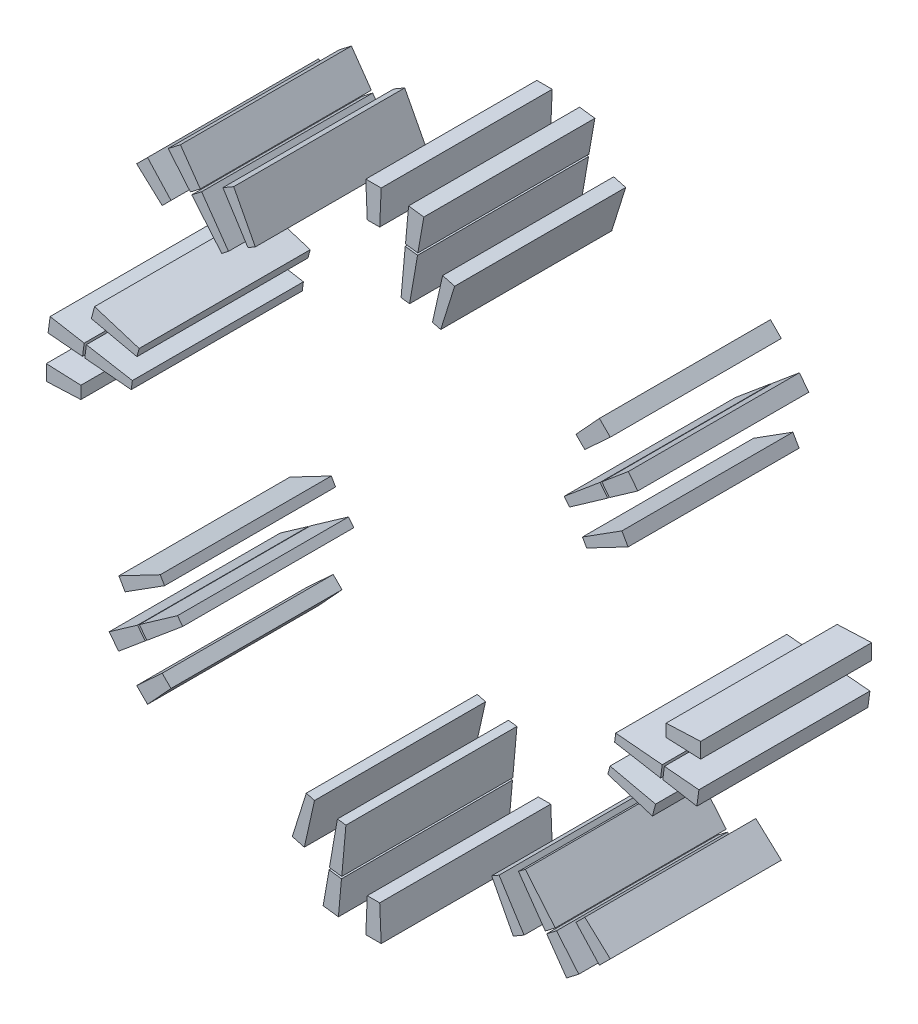
from build123d import *

# Parameters (mm, degrees)
SLOT_COPPER_ENVELOPES_START    = -15
SLOT_COPPER_ENVELOPES_DEPTH    = 30
SLOT_COPPER_ENVELOPES_2_DEPTH  = 30
SLOT_COPPER_ENVELOPES_3_DEPTH  = 30
SLOT_COPPER_ENVELOPES_4_DEPTH  = 30
SLOT_COPPER_ENVELOPES_5_DEPTH  = 30
SLOT_COPPER_ENVELOPES_6_DEPTH  = 30
SLOT_COPPER_ENVELOPES_7_DEPTH  = 30
SLOT_COPPER_ENVELOPES_8_DEPTH  = 30
SLOT_COPPER_ENVELOPES_9_DEPTH  = 30
SLOT_COPPER_ENVELOPES_10_DEPTH = 30
SLOT_COPPER_ENVELOPES_11_DEPTH = 30
SLOT_COPPER_ENVELOPES_12_DEPTH = 30
SLOT_COPPER_ENVELOPES_13_DEPTH = 30
SLOT_COPPER_ENVELOPES_14_DEPTH = 30
SLOT_COPPER_ENVELOPES_15_DEPTH = 30
SLOT_COPPER_ENVELOPES_16_DEPTH = 30
SLOT_COPPER_ENVELOPES_17_DEPTH = 30
SLOT_COPPER_ENVELOPES_18_DEPTH = 30
SLOT_COPPER_ENVELOPES_19_DEPTH = 30
SLOT_COPPER_ENVELOPES_20_DEPTH = 30
SLOT_COPPER_ENVELOPES_21_DEPTH = 30
SLOT_COPPER_ENVELOPES_22_DEPTH = 30
SLOT_COPPER_ENVELOPES_23_DEPTH = 30
SLOT_COPPER_ENVELOPES_24_DEPTH = 30
SLOT_COPPER_ENVELOPES_25_DEPTH = 30
SLOT_COPPER_ENVELOPES_26_DEPTH = 30
SLOT_COPPER_ENVELOPES_27_DEPTH = 30
SLOT_COPPER_ENVELOPES_28_DEPTH = 30
SLOT_COPPER_ENVELOPES_29_DEPTH = 30
SLOT_COPPER_ENVELOPES_30_DEPTH = 30
SLOT_COPPER_ENVELOPES_31_DEPTH = 30
SLOT_COPPER_ENVELOPES_32_DEPTH = 30


with BuildPart() as part:
    # Эскиз1 → Slot_copper_envelopes (new body)
    with BuildSketch(Plane.XY.offset(SLOT_COPPER_ENVELOPES_START)):
        Polygon((51.326850344, -1.091818182), (57.392307692, -1.35), (57.392307692, 1.35), (51.326850344, 1.091818182), align=None)
    extrude(amount=SLOT_COPPER_ENVELOPES_DEPTH)


with BuildPart() as body_2:
    # Эскиз1 → Slot_copper_envelopes 2 (new body)
    with BuildSketch(Plane.XY.offset(SLOT_COPPER_ENVELOPES_START)):
        Polygon((37.401882176, 20.727961339), (44.659910813, 24.523688487), (43.568092631, 26.414773051), (36.651882176, 22.026999445), align=None)
    extrude(amount=SLOT_COPPER_ENVELOPES_2_DEPTH)


with BuildPart() as body_3:
    # Эскиз1 → Slot_copper_envelopes 3 (new body)
    with BuildSketch(Plane.XY.offset(SLOT_COPPER_ENVELOPES_START)):
        Polygon((41.384984963, 30.37960916), (46.354206944, 33.867196235), (44.710551086, 36.009250254), (40.05567137, 32.112004363), align=None)
    extrude(amount=SLOT_COPPER_ENVELOPES_3_DEPTH)


with BuildPart() as body_4:
    # Эскиз1 → Slot_copper_envelopes 4 (new body)
    with BuildSketch(Plane.XY.offset(SLOT_COPPER_ENVELOPES_START)):
        Polygon((34.376362023, 25.432556019), (41.076855407, 30.143173036), (39.747541814, 31.875568239), (33.46321988, 26.622586029), align=None)
    extrude(amount=SLOT_COPPER_ENVELOPES_4_DEPTH)


with BuildPart() as body_5:
    # Эскиз1 → Slot_copper_envelopes 5 (new body)
    with BuildSketch(Plane.XY.offset(SLOT_COPPER_ENVELOPES_START)):
        Polygon((37.065595975, 35.521531895), (41.537084112, 39.627895803), (39.627895803, 41.537084112), (35.521531895, 37.065595975), align=None)
    extrude(amount=SLOT_COPPER_ENVELOPES_5_DEPTH)


with BuildPart() as body_6:
    # Эскиз1 → Slot_copper_envelopes 6 (new body)
    with BuildSketch(Plane.XY.offset(SLOT_COPPER_ENVELOPES_START)):
        Polygon((11.790242493, 41.104006539), (14.238459354, 48.920192212), (12.129228595, 49.485358891), (10.341353754, 41.492235107), align=None)
    extrude(amount=SLOT_COPPER_ENVELOPES_6_DEPTH)


with BuildPart() as body_7:
    # Эскиз1 → Slot_copper_envelopes 7 (new body)
    with BuildSketch(Plane.XY.offset(SLOT_COPPER_ENVELOPES_START)):
        Polygon((7.78197586, 50.745231154), (8.829649949, 56.725098184), (6.152748823, 57.077518903), (5.617020808, 51.030252894), align=None)
    extrude(amount=SLOT_COPPER_ENVELOPES_7_DEPTH)


with BuildPart() as body_8:
    # Эскиз1 → Slot_copper_envelopes 8 (new body)
    with BuildSketch(Plane.XY.offset(SLOT_COPPER_ENVELOPES_START)):
        Polygon((6.324225876, 42.291291523), (7.731280948, 50.360165069), (5.566325896, 50.645186808), (4.837058584, 42.487080811), align=None)
    extrude(amount=SLOT_COPPER_ENVELOPES_8_DEPTH)


with BuildPart() as body_9:
    # Эскиз1 → Slot_copper_envelopes 9 (new body)
    with BuildSketch(Plane.XY.offset(SLOT_COPPER_ENVELOPES_START)):
        Polygon((1.091818182, 51.326850344), (1.35, 57.392307692), (-1.35, 57.392307692), (-1.091818182, 51.326850344), align=None)
    extrude(amount=SLOT_COPPER_ENVELOPES_9_DEPTH)


with BuildPart() as body_10:
    # Эскиз1 → Slot_copper_envelopes 10 (new body)
    with BuildSketch(Plane.XY.offset(SLOT_COPPER_ENVELOPES_START)):
        Polygon((-20.727961339, 37.401882176), (-24.523688487, 44.659910813), (-26.414773051, 43.568092631), (-22.026999445, 36.651882176), align=None)
    extrude(amount=SLOT_COPPER_ENVELOPES_10_DEPTH)


with BuildPart() as body_11:
    # Эскиз1 → Slot_copper_envelopes 11 (new body)
    with BuildSketch(Plane.XY.offset(SLOT_COPPER_ENVELOPES_START)):
        Polygon((-30.37960916, 41.384984963), (-33.867196235, 46.354206944), (-36.009250254, 44.710551086), (-32.112004363, 40.05567137), align=None)
    extrude(amount=SLOT_COPPER_ENVELOPES_11_DEPTH)


with BuildPart() as body_12:
    # Эскиз1 → Slot_copper_envelopes 12 (new body)
    with BuildSketch(Plane.XY.offset(SLOT_COPPER_ENVELOPES_START)):
        Polygon((-25.432556019, 34.376362023), (-30.143173036, 41.076855407), (-31.875568239, 39.747541814), (-26.622586029, 33.46321988), align=None)
    extrude(amount=SLOT_COPPER_ENVELOPES_12_DEPTH)


with BuildPart() as body_13:
    # Эскиз1 → Slot_copper_envelopes 13 (new body)
    with BuildSketch(Plane.XY.offset(SLOT_COPPER_ENVELOPES_START)):
        Polygon((-35.521531895, 37.065595975), (-39.627895803, 41.537084112), (-41.537084112, 39.627895803), (-37.065595975, 35.521531895), align=None)
    extrude(amount=SLOT_COPPER_ENVELOPES_13_DEPTH)


with BuildPart() as body_14:
    # Эскиз1 → Slot_copper_envelopes 14 (new body)
    with BuildSketch(Plane.XY.offset(SLOT_COPPER_ENVELOPES_START)):
        Polygon((-41.104006539, 11.790242493), (-48.920192212, 14.238459354), (-49.485358891, 12.129228595), (-41.492235107, 10.341353754), align=None)
    extrude(amount=SLOT_COPPER_ENVELOPES_14_DEPTH)


with BuildPart() as body_15:
    # Эскиз1 → Slot_copper_envelopes 15 (new body)
    with BuildSketch(Plane.XY.offset(SLOT_COPPER_ENVELOPES_START)):
        Polygon((-50.745231154, 7.78197586), (-56.725098184, 8.829649949), (-57.077518903, 6.152748823), (-51.030252894, 5.617020808), align=None)
    extrude(amount=SLOT_COPPER_ENVELOPES_15_DEPTH)


with BuildPart() as body_16:
    # Эскиз1 → Slot_copper_envelopes 16 (new body)
    with BuildSketch(Plane.XY.offset(SLOT_COPPER_ENVELOPES_START)):
        Polygon((-42.291291523, 6.324225876), (-50.360165069, 7.731280948), (-50.645186808, 5.566325896), (-42.487080811, 4.837058584), align=None)
    extrude(amount=SLOT_COPPER_ENVELOPES_16_DEPTH)


with BuildPart() as body_17:
    # Эскиз1 → Slot_copper_envelopes 17 (new body)
    with BuildSketch(Plane.XY.offset(SLOT_COPPER_ENVELOPES_START)):
        Polygon((-51.326850344, 1.091818182), (-57.392307692, 1.35), (-57.392307692, -1.35), (-51.326850344, -1.091818182), align=None)
    extrude(amount=SLOT_COPPER_ENVELOPES_17_DEPTH)


with BuildPart() as body_18:
    # Эскиз1 → Slot_copper_envelopes 18 (new body)
    with BuildSketch(Plane.XY.offset(SLOT_COPPER_ENVELOPES_START)):
        Polygon((-37.401882176, -20.727961339), (-44.659910813, -24.523688487), (-43.568092631, -26.414773051), (-36.651882176, -22.026999445), align=None)
    extrude(amount=SLOT_COPPER_ENVELOPES_18_DEPTH)


with BuildPart() as body_19:
    # Эскиз1 → Slot_copper_envelopes 19 (new body)
    with BuildSketch(Plane.XY.offset(SLOT_COPPER_ENVELOPES_START)):
        Polygon((-41.384984963, -30.37960916), (-46.354206944, -33.867196235), (-44.710551086, -36.009250254), (-40.05567137, -32.112004363), align=None)
    extrude(amount=SLOT_COPPER_ENVELOPES_19_DEPTH)


with BuildPart() as body_20:
    # Эскиз1 → Slot_copper_envelopes 20 (new body)
    with BuildSketch(Plane.XY.offset(SLOT_COPPER_ENVELOPES_START)):
        Polygon((-34.376362023, -25.432556019), (-41.076855407, -30.143173036), (-39.747541814, -31.875568239), (-33.46321988, -26.622586029), align=None)
    extrude(amount=SLOT_COPPER_ENVELOPES_20_DEPTH)


with BuildPart() as body_21:
    # Эскиз1 → Slot_copper_envelopes 21 (new body)
    with BuildSketch(Plane.XY.offset(SLOT_COPPER_ENVELOPES_START)):
        Polygon((-37.065595975, -35.521531895), (-41.537084112, -39.627895803), (-39.627895803, -41.537084112), (-35.521531895, -37.065595975), align=None)
    extrude(amount=SLOT_COPPER_ENVELOPES_21_DEPTH)


with BuildPart() as body_22:
    # Эскиз1 → Slot_copper_envelopes 22 (new body)
    with BuildSketch(Plane.XY.offset(SLOT_COPPER_ENVELOPES_START)):
        Polygon((-11.790242493, -41.104006539), (-14.238459354, -48.920192212), (-12.129228595, -49.485358891), (-10.341353754, -41.492235107), align=None)
    extrude(amount=SLOT_COPPER_ENVELOPES_22_DEPTH)


with BuildPart() as body_23:
    # Эскиз1 → Slot_copper_envelopes 23 (new body)
    with BuildSketch(Plane.XY.offset(SLOT_COPPER_ENVELOPES_START)):
        Polygon((-7.78197586, -50.745231154), (-8.829649949, -56.725098184), (-6.152748823, -57.077518903), (-5.617020808, -51.030252894), align=None)
    extrude(amount=SLOT_COPPER_ENVELOPES_23_DEPTH)


with BuildPart() as body_24:
    # Эскиз1 → Slot_copper_envelopes 24 (new body)
    with BuildSketch(Plane.XY.offset(SLOT_COPPER_ENVELOPES_START)):
        Polygon((-6.324225876, -42.291291523), (-7.731280948, -50.360165069), (-5.566325896, -50.645186808), (-4.837058584, -42.487080811), align=None)
    extrude(amount=SLOT_COPPER_ENVELOPES_24_DEPTH)


with BuildPart() as body_25:
    # Эскиз1 → Slot_copper_envelopes 25 (new body)
    with BuildSketch(Plane.XY.offset(SLOT_COPPER_ENVELOPES_START)):
        Polygon((-1.091818182, -51.326850344), (-1.35, -57.392307692), (1.35, -57.392307692), (1.091818182, -51.326850344), align=None)
    extrude(amount=SLOT_COPPER_ENVELOPES_25_DEPTH)


with BuildPart() as body_26:
    # Эскиз1 → Slot_copper_envelopes 26 (new body)
    with BuildSketch(Plane.XY.offset(SLOT_COPPER_ENVELOPES_START)):
        Polygon((20.727961339, -37.401882176), (24.523688487, -44.659910813), (26.414773051, -43.568092631), (22.026999445, -36.651882176), align=None)
    extrude(amount=SLOT_COPPER_ENVELOPES_26_DEPTH)


with BuildPart() as body_27:
    # Эскиз1 → Slot_copper_envelopes 27 (new body)
    with BuildSketch(Plane.XY.offset(SLOT_COPPER_ENVELOPES_START)):
        Polygon((30.37960916, -41.384984963), (33.867196235, -46.354206944), (36.009250254, -44.710551086), (32.112004363, -40.05567137), align=None)
    extrude(amount=SLOT_COPPER_ENVELOPES_27_DEPTH)


with BuildPart() as body_28:
    # Эскиз1 → Slot_copper_envelopes 28 (new body)
    with BuildSketch(Plane.XY.offset(SLOT_COPPER_ENVELOPES_START)):
        Polygon((25.432556019, -34.376362023), (30.143173036, -41.076855407), (31.875568239, -39.747541814), (26.622586029, -33.46321988), align=None)
    extrude(amount=SLOT_COPPER_ENVELOPES_28_DEPTH)


with BuildPart() as body_29:
    # Эскиз1 → Slot_copper_envelopes 29 (new body)
    with BuildSketch(Plane.XY.offset(SLOT_COPPER_ENVELOPES_START)):
        Polygon((35.521531895, -37.065595975), (39.627895803, -41.537084112), (41.537084112, -39.627895803), (37.065595975, -35.521531895), align=None)
    extrude(amount=SLOT_COPPER_ENVELOPES_29_DEPTH)


with BuildPart() as body_30:
    # Эскиз1 → Slot_copper_envelopes 30 (new body)
    with BuildSketch(Plane.XY.offset(SLOT_COPPER_ENVELOPES_START)):
        Polygon((41.104006539, -11.790242493), (48.920192212, -14.238459354), (49.485358891, -12.129228595), (41.492235107, -10.341353754), align=None)
    extrude(amount=SLOT_COPPER_ENVELOPES_30_DEPTH)


with BuildPart() as body_31:
    # Эскиз1 → Slot_copper_envelopes 31 (new body)
    with BuildSketch(Plane.XY.offset(SLOT_COPPER_ENVELOPES_START)):
        Polygon((50.745231154, -7.78197586), (56.725098184, -8.829649949), (57.077518903, -6.152748823), (51.030252894, -5.617020808), align=None)
    extrude(amount=SLOT_COPPER_ENVELOPES_31_DEPTH)


with BuildPart() as body_32:
    # Эскиз1 → Slot_copper_envelopes 32 (new body)
    with BuildSketch(Plane.XY.offset(SLOT_COPPER_ENVELOPES_START)):
        Polygon((42.291291523, -6.324225876), (50.360165069, -7.731280948), (50.645186808, -5.566325896), (42.487080811, -4.837058584), align=None)
    extrude(amount=SLOT_COPPER_ENVELOPES_32_DEPTH)


solid = Compound([part.part, body_2.part, body_3.part, body_4.part, body_5.part, body_6.part, body_7.part, body_8.part, body_9.part, body_10.part, body_11.part, body_12.part, body_13.part, body_14.part, body_15.part, body_16.part, body_17.part, body_18.part, body_19.part, body_20.part, body_21.part, body_22.part, body_23.part, body_24.part, body_25.part, body_26.part, body_27.part, body_28.part, body_29.part, body_30.part, body_31.part, body_32.part])
